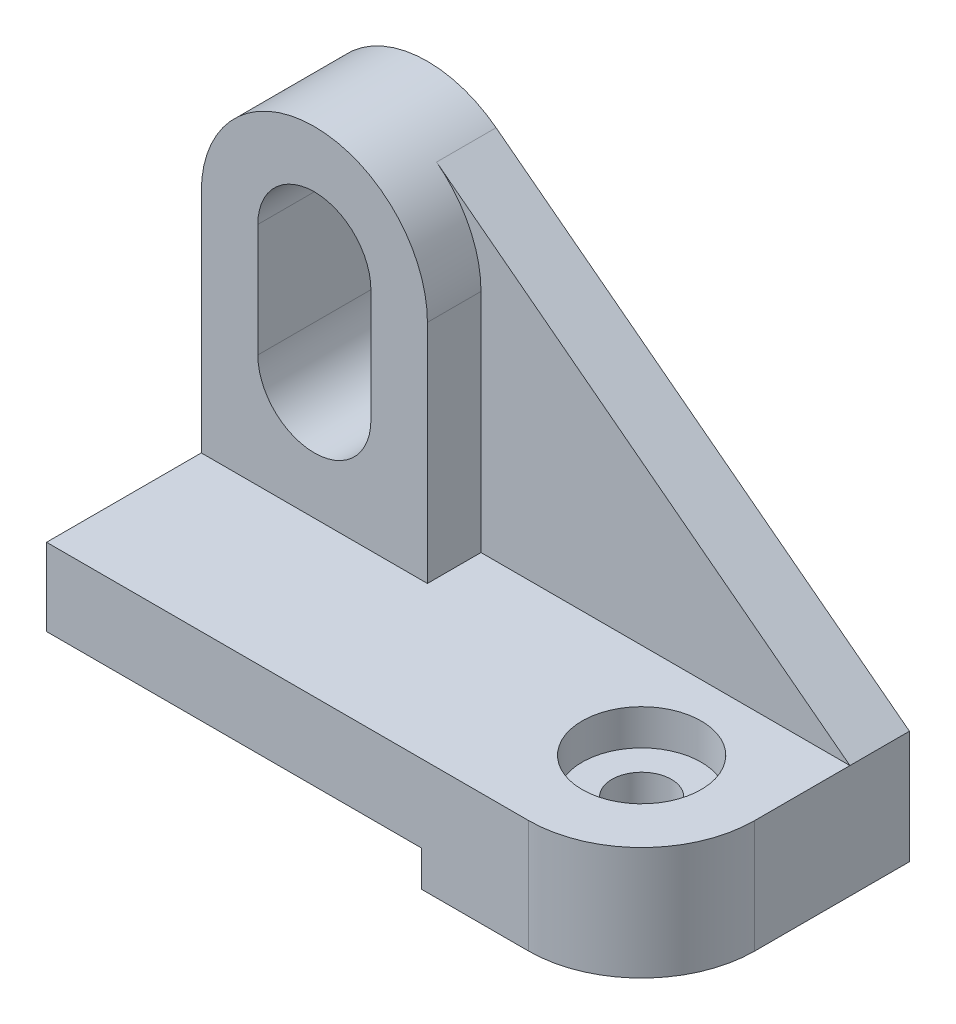
from build123d import *

# Parameters (mm, degrees)
BOSS_EXTRUDE1_DEPTH                     = 45
BOSS_EXTRUDE2_DEPTH                     = 19
BOSS_EXTRUDE3_DEPTH                     = 10
FILLET1_R                               = 19
CBORE_FOR_M5_HEX_HEAD_BOLT1_D           = 10
CBORE_FOR_M5_HEX_HEAD_BOLT1_DEPTH       = 20
CBORE_FOR_M5_HEX_HEAD_BOLT1_CBORE_D     = 20
CBORE_FOR_M5_HEX_HEAD_BOLT1_CBORE_DEPTH = 6
CBORE_FOR_M5_HEX_HEAD_BOLT1_TIP         = 2.886751346


with BuildPart() as part:
    # Sketch1 → Boss-Extrude1 (new body)
    with BuildSketch(Plane.XY):
        Polygon((0, 13), (0, 0), (63, 0), (63, -6), (100, -6), (100, 13), (38, 13), align=None)
    extrude(amount=BOSS_EXTRUDE1_DEPTH)

    # Sketch1<3> → Boss-Extrude2 (add)
    with BuildSketch(Plane.XY):
        with BuildLine():
            Line((0, 51), (0, 13))
            Line((0, 13), (38, 13))
            Line((38, 13), (38, 51))
            ThreePointArc((38, 51), (36.032775759, 59.419296285), (30.538468428, 66.095156386))
            ThreePointArc((30.538468428, 66.095156386), (10.580703715, 68.032775759), (0, 51))
        make_face()
        with BuildLine():
            Line((9.5, 32), (9.5, 51))
            ThreePointArc((9.5, 51), (19, 60.5), (28.5, 51))
            Line((28.5, 51), (28.5, 32))
            ThreePointArc((28.5, 32), (19, 22.5), (9.5, 32))
        make_face(mode=Mode.SUBTRACT)
    extrude(amount=BOSS_EXTRUDE2_DEPTH)

    # Sketch1<4> → Boss-Extrude3 (add)
    with BuildSketch(Plane.XY):
        with BuildLine():
            Line((38, 51), (38, 13))
            Line((38, 13), (100, 13))
            Line((100, 13), (30.538468428, 66.095156386))
            ThreePointArc((30.538468428, 66.095156386), (36.032775759, 59.419296285), (38, 51))
        make_face()
    extrude(amount=BOSS_EXTRUDE3_DEPTH)

    # Fillet1
    fillet1_edges = [part.edges().sort_by_distance(p)[0] for p in [
        (100, 3.5, 45),
    ]]
    fillet(fillet1_edges, radius=FILLET1_R)

    # CBORE for M5 Hex Head Bolt1
    with Locations(Plane(origin=(0, 13, 0), x_dir=(1, 0, 0), z_dir=(0, 1, 0))):
        with Locations((81, -26)):
            CounterBoreHole(CBORE_FOR_M5_HEX_HEAD_BOLT1_D / 2, CBORE_FOR_M5_HEX_HEAD_BOLT1_CBORE_D / 2, CBORE_FOR_M5_HEX_HEAD_BOLT1_CBORE_DEPTH, depth=CBORE_FOR_M5_HEX_HEAD_BOLT1_DEPTH)
            with Locations((0, 0, -(CBORE_FOR_M5_HEX_HEAD_BOLT1_DEPTH + CBORE_FOR_M5_HEX_HEAD_BOLT1_TIP / 2))):  # 120° drill point
                Cone(0, CBORE_FOR_M5_HEX_HEAD_BOLT1_D / 2, CBORE_FOR_M5_HEX_HEAD_BOLT1_TIP, mode=Mode.SUBTRACT)


solid = part.part
